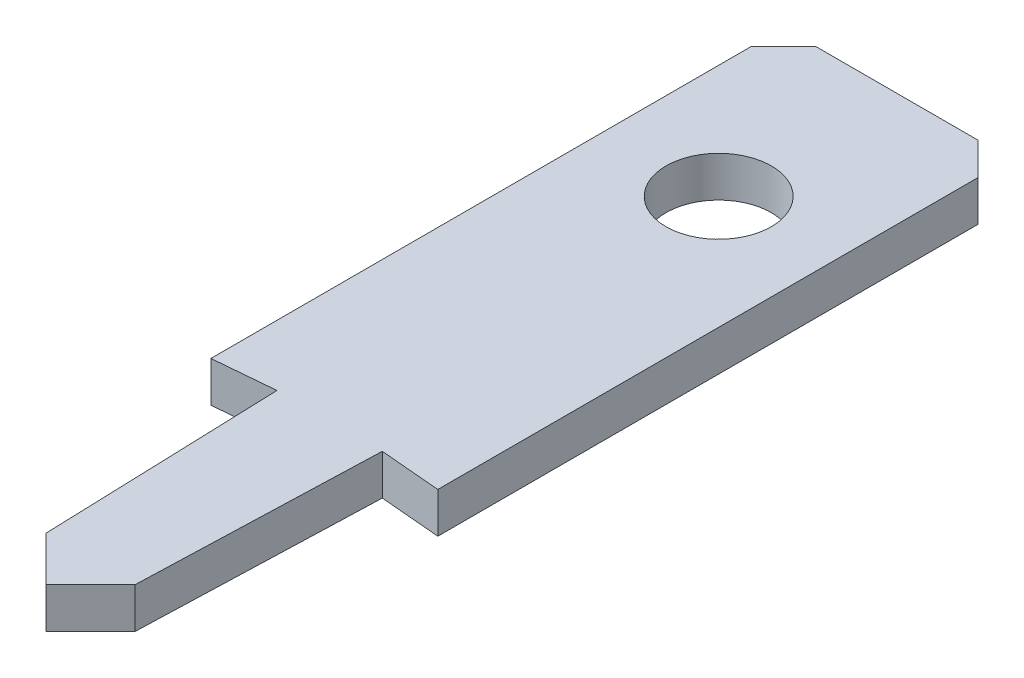
from build123d import *

# Parameters (mm, degrees)
BOSS_EXTRUDE2_DEPTH = 0.5
SKETCH3_R           = 0.65
CUT_EXTRUDE3_DEPTH  = 0.5


with BuildPart() as part:
    # Sketch1 → Boss-Extrude2 (new body)
    with BuildSketch(Plane(origin=(0, 0, 0), x_dir=(1, 0, 0), z_dir=(0, 1, 0))):
        Polygon((-1, 7), (1, 7), (1.4, 6.6), (1.4, -0.065616498), (0.65, 0), (0.55, -2.95), (0, -3.5), (-0.55, -2.95), (-0.65, 0), (-1.4, -0.065616498), (-1.4, 6.6), align=None)
    extrude(amount=BOSS_EXTRUDE2_DEPTH)

    # Sketch3 → Cut-Extrude3 (cut)
    with BuildSketch(Plane(origin=(0, 0.5, 0), x_dir=(1, 0, 0), z_dir=(0, 1, 0))):
        with Locations(Location((0, 4.8, 0), (0, 0, 270))):
            Circle(SKETCH3_R)
    extrude(amount=-CUT_EXTRUDE3_DEPTH, mode=Mode.SUBTRACT)


solid = part.part
